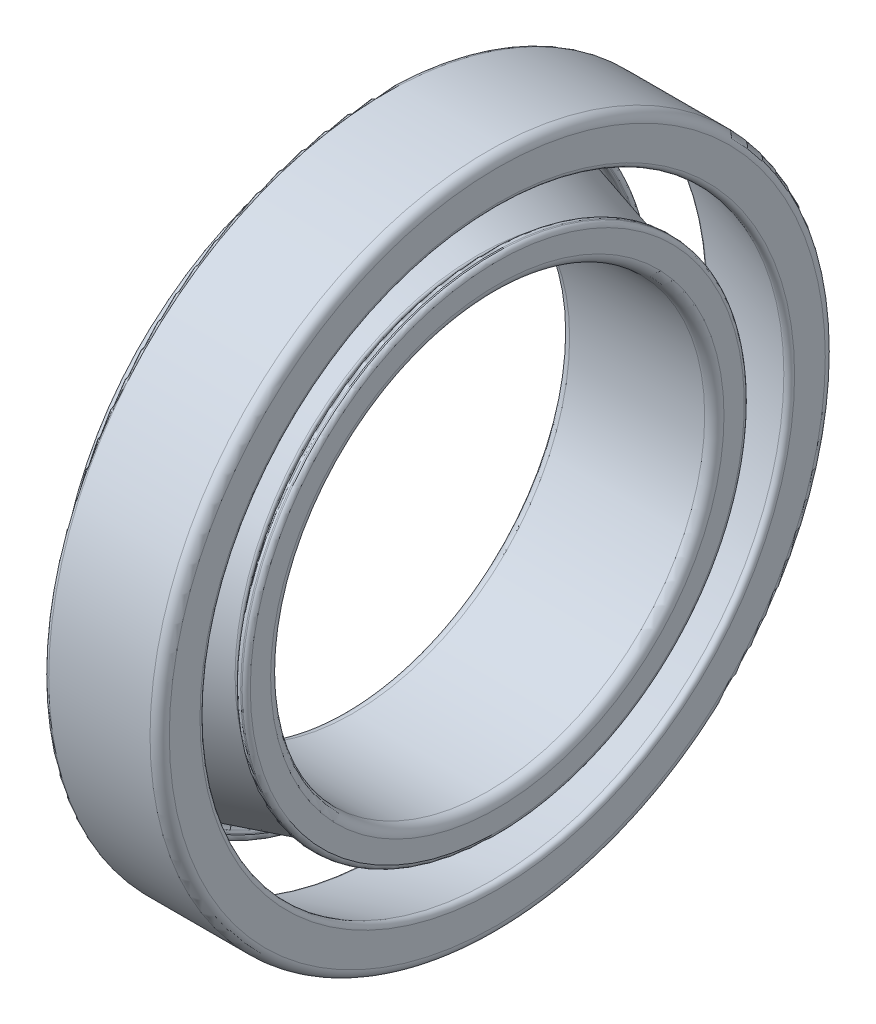
from build123d import *


with BuildPart() as part:
    # Sketch1 → Revolve1 (revolve)
    with BuildSketch(Plane.XY, mode=Mode.PRIVATE) as revolve1_sk:
        with BuildLine():
            Line((0, 68), (0, 61.639162714))
            ThreePointArc((0, 61.639162714), (-0.395033013, 60.84291216), (-1.268029889, 60.675752116))
            Line((-1.268029889, 60.675752116), (-23.268029889, 66.796359031))
            ThreePointArc((-23.268029889, 66.796359031), (-23.796250554, 67.154802641), (-24, 67.759769628))
            Line((-24, 67.759769628), (-24, 69))
            ThreePointArc((-24, 69), (-23.707106781, 69.707106781), (-23, 70))
            Line((-23, 70), (-2, 70))
            ThreePointArc((-2, 70), (-0.585786438, 69.414213562), (0, 68))
        make_face()
        with BuildLine():
            Line((-26.258121089, 56.575318538), (-3.986167238, 50.379051504))
            ThreePointArc((-3.986167238, 50.379051504), (-3.732646755, 50.213283371), (-3.621354424, 49.931564137))
            ThreePointArc((-3.621354424, 49.931564137), (-2.131990492, 49.129240082), (-2.049861037, 50.818968925))
            ThreePointArc((-2.049861037, 50.818968925), (-2.233626397, 51.059763448), (-2.244647402, 51.362468332))
            Line((-2.244647402, 51.362468332), (-2.194851083, 51.541456955))
            ThreePointArc((-2.194851083, 51.541456955), (-1.7231489, 52.144186985), (-0.963410597, 52.236837663))
            Line((-0.963410597, 52.236837663), (-0.731970111, 52.172448743))
            ThreePointArc((-0.731970111, 52.172448743), (-0.203749446, 51.814005133), (0, 51.209038146))
            Line((0, 51.209038146), (0, 47))
            ThreePointArc((0, 47), (-0.585786438, 45.585786438), (-2, 45))
            Line((-2, 45), (-30, 45))
            ThreePointArc((-30, 45), (-31.414213562, 45.585786438), (-32, 47))
            Line((-32, 47), (-32, 58.239131864))
            ThreePointArc((-32, 58.239131864), (-31.209933974, 59.831632972), (-29.463940222, 60.165953058))
            Line((-29.463940222, 60.165953058), (-27.887122307, 59.727267484))
            ThreePointArc((-27.887122307, 59.727267484), (-27.284392277, 59.255565301), (-27.191741599, 58.495826997))
            Line((-27.191741599, 58.495826997), (-27.241537917, 58.316838375))
            ThreePointArc((-27.241537917, 58.316838375), (-27.407306051, 58.063317891), (-27.689025284, 57.95202556))
            ThreePointArc((-27.689025284, 57.95202556), (-28.49134934, 56.462661628), (-26.801620496, 56.380532173))
            ThreePointArc((-26.801620496, 56.380532173), (-26.560825973, 56.564297533), (-26.258121089, 56.575318538))
        make_face()
    revolve(revolve1_sk.sketch.rotate(Axis((0, 0, 0), (1, 0, 0)), 90), axis=Axis((0, 0, 0), (1, 0, 0)))


solid = part.part
